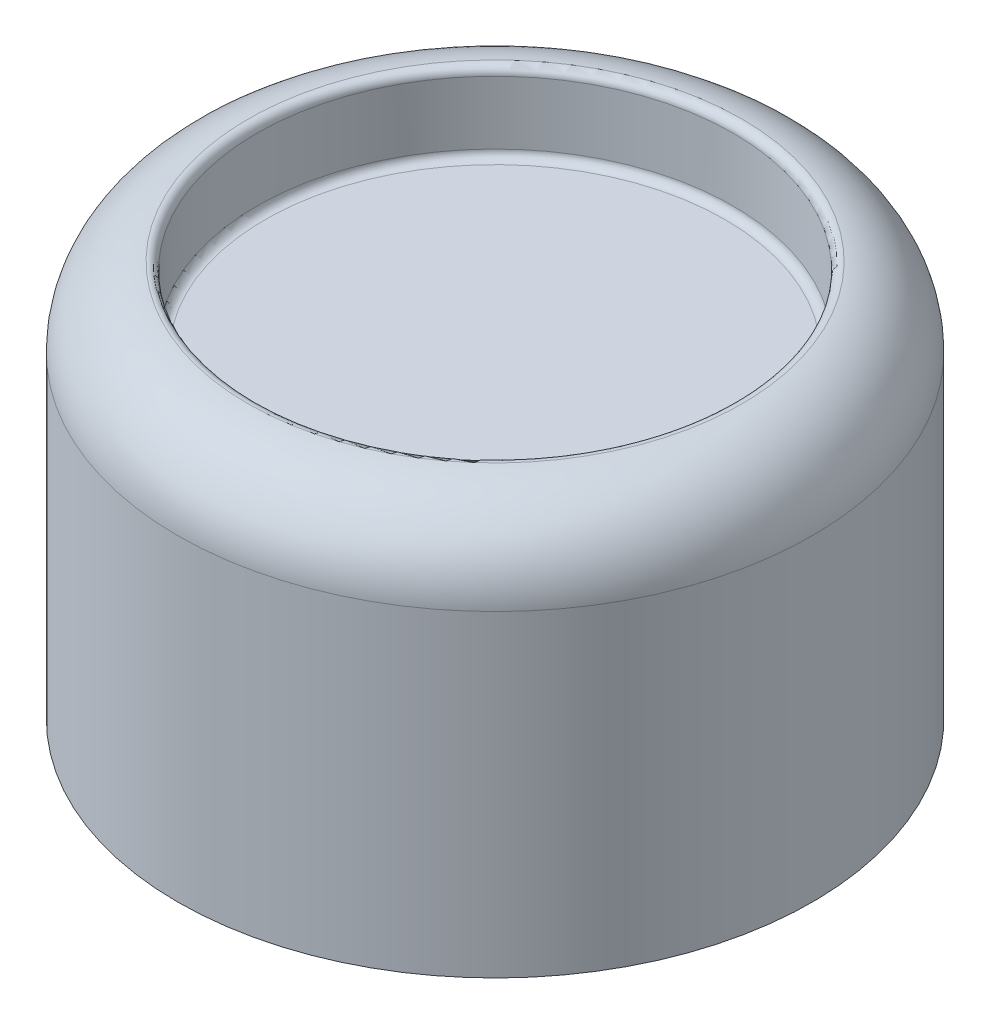
from build123d import *

# Parameters (mm, degrees)
SKETCH1_R           = 4
BOSS_EXTRUDE1_DEPTH = 5
FILLET1_R           = 1
SKETCH2_R           = 3
CUT_EXTRUDE1_DEPTH  = 1
FILLET2_R           = 0.1
CUT_EXTRUDE3_START  = -3.5
SKETCH3_R           = 3
SKETCH3_R_2         = 1.2
CUT_EXTRUDE3_DEPTH  = 3.5
SKETCH4_R           = 0.5
CUT_EXTRUDE4_DEPTH  = 3.5
FILLET3_R           = 0.5


with BuildPart() as part:
    # Sketch1 → Boss-Extrude1 (new body)
    with BuildSketch(Plane(origin=(0, 0, 0), x_dir=(1, 0, 0), z_dir=(0, 1, 0))):
        with Locations(Location((0, 0, 0), (0, 0, 270))):
            Circle(SKETCH1_R)
    extrude(amount=BOSS_EXTRUDE1_DEPTH)

    # Fillet1
    fillet1_edges = [part.edges().sort_by_distance(p)[0] for p in [
        (0, 5, -4),
    ]]
    fillet(fillet1_edges, radius=FILLET1_R)

    # Sketch2 → Cut-Extrude1 (cut)
    with BuildSketch(Plane(origin=(0, 5, 0), x_dir=(1, 0, 0), z_dir=(0, 1, 0))):
        with Locations(Location((0, 0, 0), (0, 0, 270))):
            Circle(SKETCH2_R)
    extrude(amount=-CUT_EXTRUDE1_DEPTH, mode=Mode.SUBTRACT)

    # Fillet2
    fillet2_edges = [part.edges().sort_by_distance(p)[0] for p in [
        (0, 5, -3),
        (0, 4, -3),
    ]]
    fillet(fillet2_edges, radius=FILLET2_R)

    # Sketch3 → Cut-Extrude3 (cut)
    with BuildSketch(Plane.XZ.offset(CUT_EXTRUDE3_START)):
        with Locations(Location((0, 0, 0), (0, 0, 90))):
            Circle(SKETCH3_R)
        with Locations(Location((0, 0, 0), (0, 0, 270))):
            Circle(SKETCH3_R_2, mode=Mode.SUBTRACT)
    extrude(amount=CUT_EXTRUDE3_DEPTH, mode=Mode.SUBTRACT)

    # Sketch4 → Cut-Extrude4 (cut)
    with BuildSketch(Plane.XZ):
        with Locations(Location((0, 0, 0), (0, 0, 270))):
            Circle(SKETCH4_R)
    extrude(amount=-CUT_EXTRUDE4_DEPTH, mode=Mode.SUBTRACT)

    # Fillet3
    fillet3_edges = [part.edges().sort_by_distance(p)[0] for p in [
        (0, 0, 1.2),
    ]]
    fillet(fillet3_edges, radius=FILLET3_R)


solid = part.part
